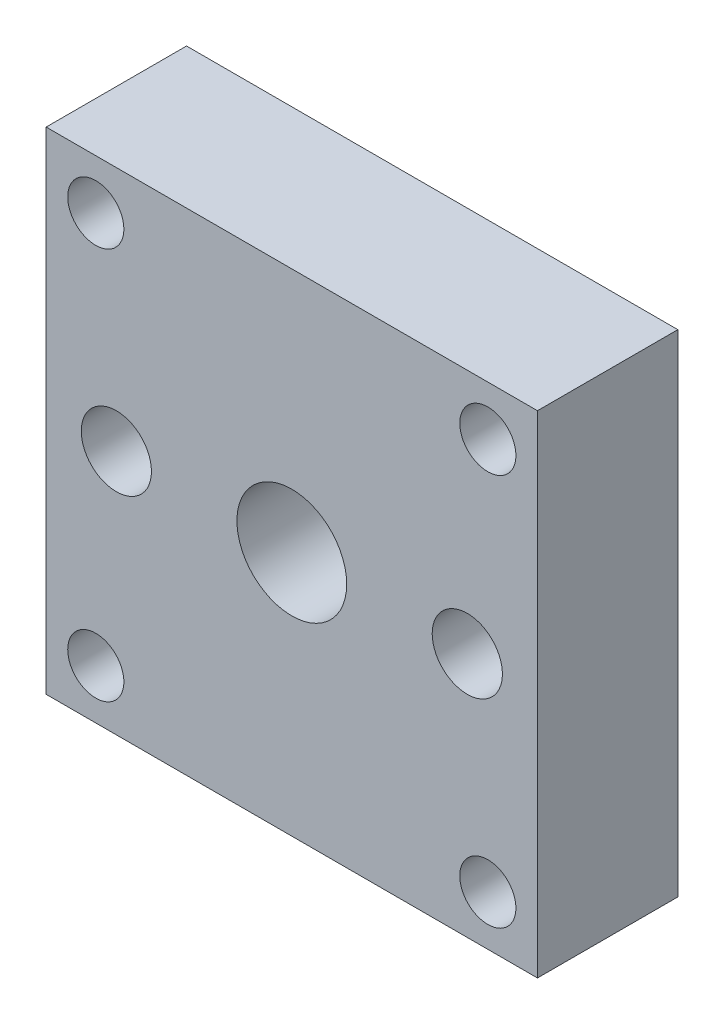
from build123d import *

# Parameters (mm, degrees)
SKETCH1_W           = 35
SKETCH1_H           = 35
SKETCH1_R           = 3.91
SKETCH1_R_2         = 2
SKETCH1_R_3         = 2.5
BOSS_EXTRUDE1_DEPTH = 10


with BuildPart() as part:
    # Sketch1 → Boss-Extrude1 (new body)
    with BuildSketch(Plane.XY):
        with Locations((8.031937938, -5.058807352)):
            Rectangle(SKETCH1_W, SKETCH1_H)
        with Locations((8.031937938, -5.058807352)):
            Circle(SKETCH1_R, mode=Mode.SUBTRACT)
        with Locations((21.996404032, -19.023273446)):
            Circle(SKETCH1_R_2, mode=Mode.SUBTRACT)
        with Locations(Location((21.996404032, 8.905658742, 0), (0, 0, 180))):
            Circle(SKETCH1_R_2, mode=Mode.SUBTRACT)
        with Locations(Location((-5.932528156, -19.023273446, 0), (0, 0, 180))):
            Circle(SKETCH1_R_2, mode=Mode.SUBTRACT)
        with Locations((-5.932528156, 8.905658742)):
            Circle(SKETCH1_R_2, mode=Mode.SUBTRACT)
        with Locations((-4.468062062, -5.058807352)):
            Circle(SKETCH1_R_3, mode=Mode.SUBTRACT)
        with Locations(Location((20.531937938, -5.058807352, 0), (0, 0, 180))):
            Circle(SKETCH1_R_3, mode=Mode.SUBTRACT)
    extrude(amount=BOSS_EXTRUDE1_DEPTH)


solid = part.part
